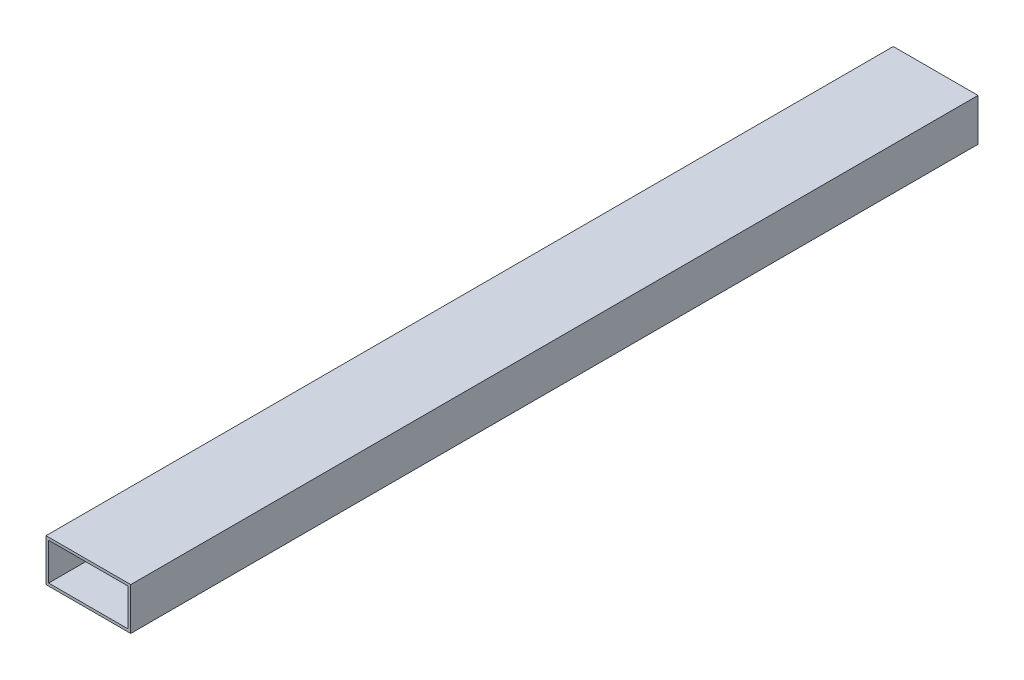
from build123d import *

# Parameters (mm, degrees)
SKETCH1_W           = 50.8
SKETCH1_H           = 25.4
SKETCH1_W_2         = 47.625
SKETCH1_H_2         = 22.225
BOSS_EXTRUDE1_DEPTH = 508


with BuildPart() as part:
    # Sketch1 → Boss-Extrude1 (new body)
    with BuildSketch(Plane.XY):
        with Locations((25.4, 12.7)):
            Rectangle(SKETCH1_W, SKETCH1_H)
        with Locations((25.4, 12.7)):
            Rectangle(SKETCH1_W_2, SKETCH1_H_2, mode=Mode.SUBTRACT)
    extrude(amount=BOSS_EXTRUDE1_DEPTH)


solid = part.part
